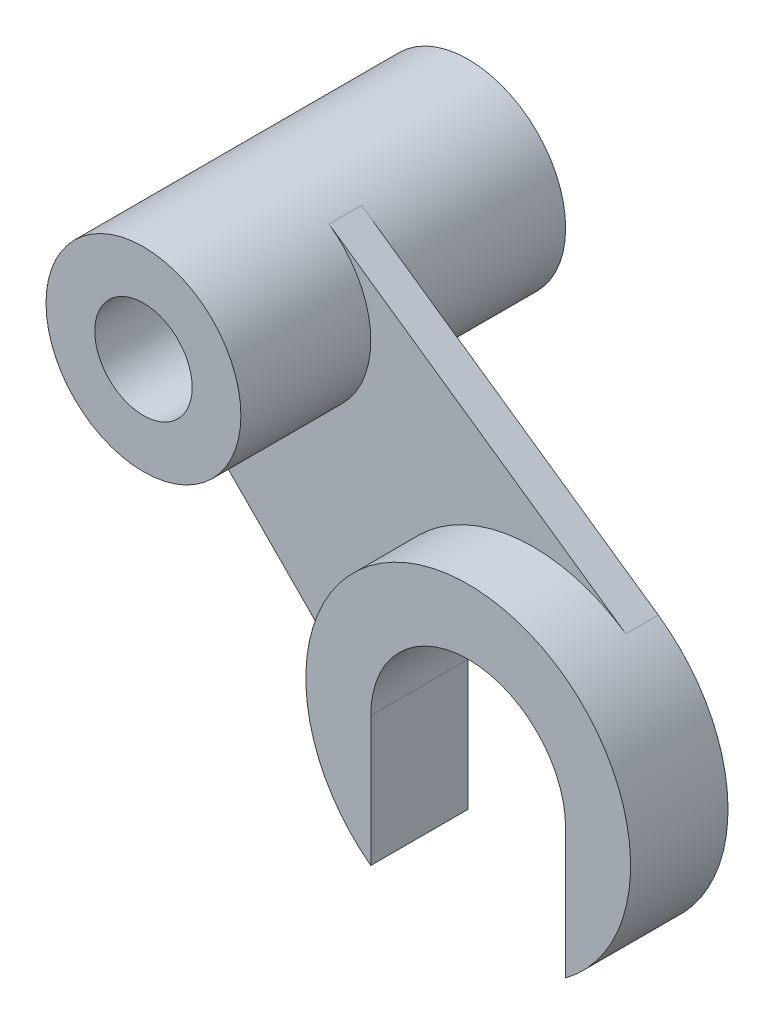
from build123d import *

# Parameters (mm, degrees)
SKETCH1_R           = 15
BOSS_EXTRUDE1_DEPTH = 100
BOSS_EXTRUDE2_START = 50
BOSS_EXTRUDE2_DEPTH = 10
BOSS_EXTRUDE3_START = 50
BOSS_EXTRUDE3_DEPTH = 30


with BuildPart() as part:
    # Sketch1 → Boss-Extrude1 (new body)
    with BuildSketch(Plane.XY):
        with BuildLine():
            ThreePointArc((47.129116361, 64.629116361), (16.105279615, 66.588282107), (0, 40))
            ThreePointArc((0, 40), (30, 10), (60, 40))
            ThreePointArc((60, 40), (56.588282107, 53.894720385), (47.129116361, 64.629116361))
        make_face()
        with Locations((30, 40)):
            Circle(SKETCH1_R, mode=Mode.SUBTRACT)
    extrude(amount=BOSS_EXTRUDE1_DEPTH)

    # Sketch1<3> → Boss-Extrude2 (add)
    with BuildSketch(Plane.XY.offset(BOSS_EXTRUDE2_START)):
        with BuildLine():
            Line((0, 0), (74.477364607, -75.187247331))
            ThreePointArc((74.477364607, -75.187247331), (71.7229458, -7.830649341), (138.548527268, 1.048527268))
            Line((138.548527268, 1.048527268), (47.129116361, 64.629116361))
            ThreePointArc((47.129116361, 64.629116361), (56.588282107, 53.894720385), (60, 40))
            ThreePointArc((60, 40), (30, 10), (0, 40))
            Line((0, 40), (0, 0))
        make_face()
    extrude(amount=BOSS_EXTRUDE2_DEPTH)

    # Sketch1<4> → Boss-Extrude3 (add)
    with BuildSketch(Plane.XY.offset(BOSS_EXTRUDE3_START)):
        with BuildLine():
            Line((80, -80), (80, -40))
            ThreePointArc((80, -40), (110, -10), (140, -40))
            Line((140, -40), (140, -80))
            ThreePointArc((140, -80), (159.991983901, -39.104709192), (138.548527268, 1.048527268))
            ThreePointArc((138.548527268, 1.048527268), (71.7229458, -7.830649341), (74.477364607, -75.187247331))
            ThreePointArc((74.477364607, -75.187247331), (77.1504249, -77.694899068), (80, -80))
        make_face()
    extrude(amount=BOSS_EXTRUDE3_DEPTH)


solid = part.part
